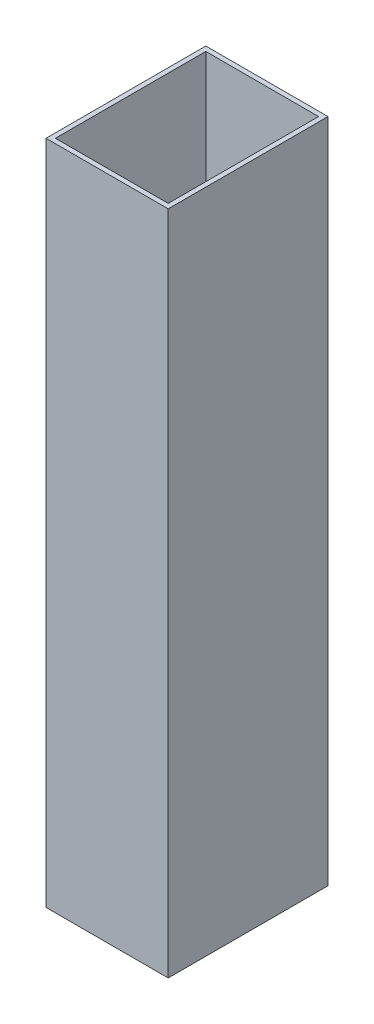
from build123d import *

# Parameters (mm, degrees)
ESQUISSE1_W             = 82.55
ESQUISSE1_H             = 450
BOSS_EXTRU_1_DEPTH      = 107.95
ESQUISSE2_W             = 76.2
ESQUISSE2_H             = 101.6
ENL_V_MAT_EXTRU_1_DEPTH = 450


with BuildPart() as part:
    # Esquisse1 → Boss.-Extru.1 (new body)
    with BuildSketch(Plane.XY):
        Rectangle(ESQUISSE1_W, ESQUISSE1_H)
    extrude(amount=BOSS_EXTRU_1_DEPTH)

    # Esquisse2 → Enlèv. mat.-Extru.1 (cut)
    with BuildSketch(Plane(origin=(0, 225, 0), x_dir=(1, 0, 0), z_dir=(0, 1, 0))):
        with Locations((0, -53.975)):
            Rectangle(ESQUISSE2_W, ESQUISSE2_H)
    extrude(amount=-ENL_V_MAT_EXTRU_1_DEPTH, mode=Mode.SUBTRACT)


solid = part.part
